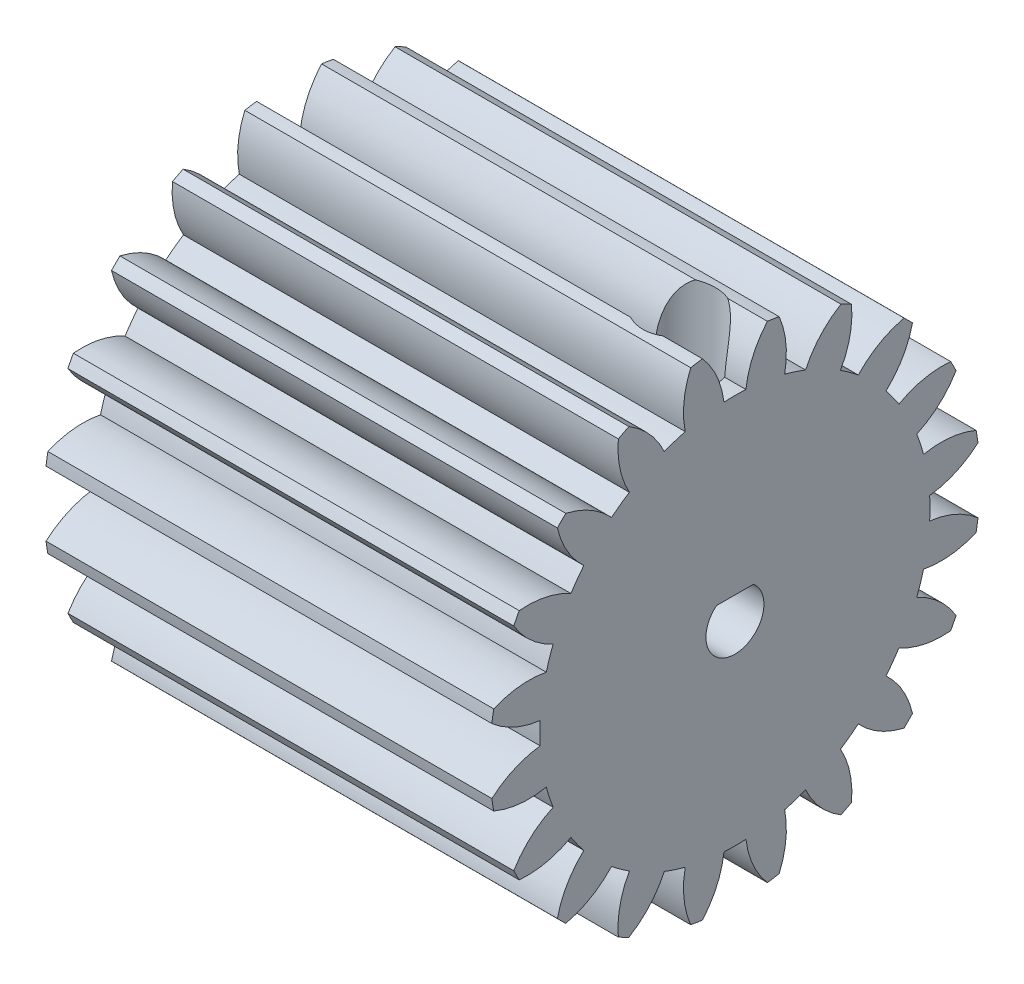
from build123d import *

# Parameters (mm, degrees)
BASPROSKE_W         = 40
BASPROSKE_H         = 22
TOOTHCUT_DEPTH      = 51.675437837
TEETHCUTS_COUNT     = 20
TEETHCUTS_ANGLE     = 342
BORSKE_R            = 0.4
BORE_DEPTH          = 50.0000508
SKETCH1_R           = 2.6
CUT_EXTRUDE1_DEPTH  = 51.50774594
BOSS_EXTRUDE1_DEPTH = 40
BOSS_EXTRUDE2_START = -10
BOSS_EXTRUDE2_DEPTH = 10
SKETCH4_R           = 3.25
CUT_EXTRUDE2_DEPTH  = 54.373293014
CUT_EXTRUDE3_REACH  = 55.373
SKETCH5_R           = 1.4


with BuildPart() as part:
    # BasProSke → Base-Revolve (revolve)
    with BuildSketch(Plane(origin=(0, 0, 0), x_dir=(1, 0, 0), z_dir=(0, 1, 0)), mode=Mode.PRIVATE) as base_revolve_sk:
        with Locations((20, 11)):
            Rectangle(BASPROSKE_W, BASPROSKE_H)
    revolve(base_revolve_sk.sketch.rotate(Axis((-10, 0, 0), (1, 0, 0)), 180), axis=Axis((-10, 0, 0), (1, 0, 0)))

    # TooCutSke → ToothCut (cut, through all)
    with BuildSketch(Plane(origin=(0, 0, 0), x_dir=(0, 0, -1), z_dir=(1, 0, 0))):
        with BuildLine():
            ThreePointArc((0.986171591, 17.471189616), (0, 17.499), (-0.986171591, 17.471189616))
            ThreePointArc((-0.986171591, 17.471189616), (-1.626916196, 19.798789858), (-2.932850173, 21.829260982))
            ThreePointArc((-2.932850173, 21.829260982), (0, 22.0254), (2.932850173, 21.829260982))
            ThreePointArc((2.932850173, 21.829260982), (1.626916196, 19.798789858), (0.986171591, 17.471189616))
        make_face()
    toothcut = extrude(amount=TOOTHCUT_DEPTH, mode=Mode.SUBTRACT)

    # TeethCuts: ToothCut ×20 about axis
    teethcuts_axis = Axis((-10, 0, 0), (1, 0, 0))
    for i in range(1, TEETHCUTS_COUNT):
        add(toothcut.rotate(teethcuts_axis, i * TEETHCUTS_ANGLE / (TEETHCUTS_COUNT - 1)), mode=Mode.SUBTRACT)

    # BorSke → Bore (cut, symmetric)
    with BuildSketch(Plane(origin=(0, 0, 0), x_dir=(0, 0, -1), z_dir=(1, 0, 0))):
        with Locations(Location((0, 0, 0), (0, 0, 180))):
            Circle(BORSKE_R)
    extrude(amount=BORE_DEPTH, both=True, mode=Mode.SUBTRACT)

    # Sketch1 → Cut-Extrude1 (cut, through all)
    with BuildSketch(Plane(origin=(40, 0, 0), x_dir=(0, 0, -1), z_dir=(1, 0, 0))):
        Circle(SKETCH1_R)
    extrude(amount=-CUT_EXTRUDE1_DEPTH, mode=Mode.SUBTRACT)

    # Sketch2 → Boss-Extrude1 (add)
    with BuildSketch(Plane.ZY):
        with BuildLine():
            Line((-2.236067977, 2), (2.236067977, 2))
            ThreePointArc((2.236067977, 2), (0, 3), (-2.236067977, 2))
        make_face()
    extrude(amount=-BOSS_EXTRUDE1_DEPTH)

    # Sketch3 → Boss-Extrude2 (add)
    with BuildSketch(Plane.ZY.offset(BOSS_EXTRUDE2_START)):
        with BuildLine():
            Line((-1.661324773, 2), (1.661324773, 2))
            ThreePointArc((1.661324773, 2), (0, -2.6), (-1.661324773, 2))
        make_face()
    extrude(amount=BOSS_EXTRUDE2_DEPTH)

    # Sketch4 → Cut-Extrude2 (cut, through all)
    with BuildSketch(Plane(origin=(0, 6, 0), x_dir=(1, 0, 0), z_dir=(0, 1, 0))):
        with Locations(Location((35, 0, 0), (0, 0, 116.335173549))):
            Circle(SKETCH4_R)
    extrude(amount=CUT_EXTRUDE2_DEPTH, mode=Mode.SUBTRACT)

    # Sketch5 → Cut-Extrude3 (cut, up to next)
    with BuildSketch(Plane(origin=(0, 6, 0), x_dir=(1, 0, 0), z_dir=(0, 1, 0)), mode=Mode.PRIVATE) as cut_extrude3_sk1:
        with Locations(Location((35, 0, 0), (0, 0, 270))):
            Circle(SKETCH5_R)
    cut_extrude3_tool1 = extrude(cut_extrude3_sk1.sketch, amount=-CUT_EXTRUDE3_REACH, mode=Mode.PRIVATE) & part.part
    add(cut_extrude3_tool1.solids().sort_by_distance((35, 6, 0))[0], mode=Mode.SUBTRACT)


solid = part.part
